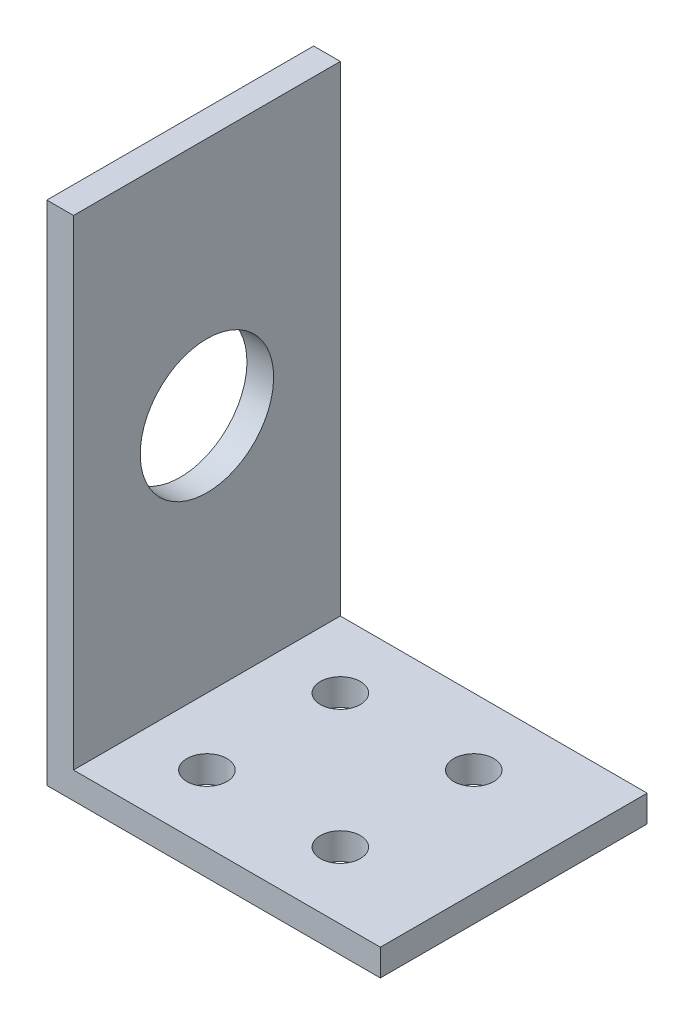
from build123d import *

# Parameters (mm, degrees)
EXTRUDE_1_DEPTH     = 20
SKETCH_3_R          = 1.5
CUT_EXTRUDE_1_DEPTH = 20
SKETCH_4_R          = 5
CUT_EXTRUDE_2_DEPTH = 20


with BuildPart() as part:
    # 草图1 → 凸台-拉伸1 (new body)
    with BuildSketch(Plane.XY):
        Polygon((0, 0), (25, 0), (25, 2), (2, 2), (2, 38), (0, 38), align=None)
    extrude(amount=EXTRUDE_1_DEPTH)

    # 草图3 → 切除-拉伸1 (cut)
    with BuildSketch(Plane(origin=(0, 2, 0), x_dir=(1, 0, 0), z_dir=(0, 1, 0))):
        with Locations(Location((17, -5, 0), (0, 0, 180))):
            Circle(SKETCH_3_R)
        with Locations(Location((17, -15, 0), (0, 0, 180))):
            Circle(SKETCH_3_R)
        with Locations(Location((7, -5, 0), (0, 0, 180))):
            Circle(SKETCH_3_R)
        with Locations(Location((7, -15, 0), (0, 0, 180))):
            Circle(SKETCH_3_R)
    extrude(amount=-CUT_EXTRUDE_1_DEPTH, mode=Mode.SUBTRACT)

    # 草图4 → 切除-拉伸2 (cut)
    with BuildSketch(Plane(origin=(2, 0, 0), x_dir=(0, 0, -1), z_dir=(1, 0, 0))):
        with Locations(Location((-10, 20, 0), (0, 0, 90))):
            Circle(SKETCH_4_R)
    extrude(amount=-CUT_EXTRUDE_2_DEPTH, mode=Mode.SUBTRACT)


solid = part.part
